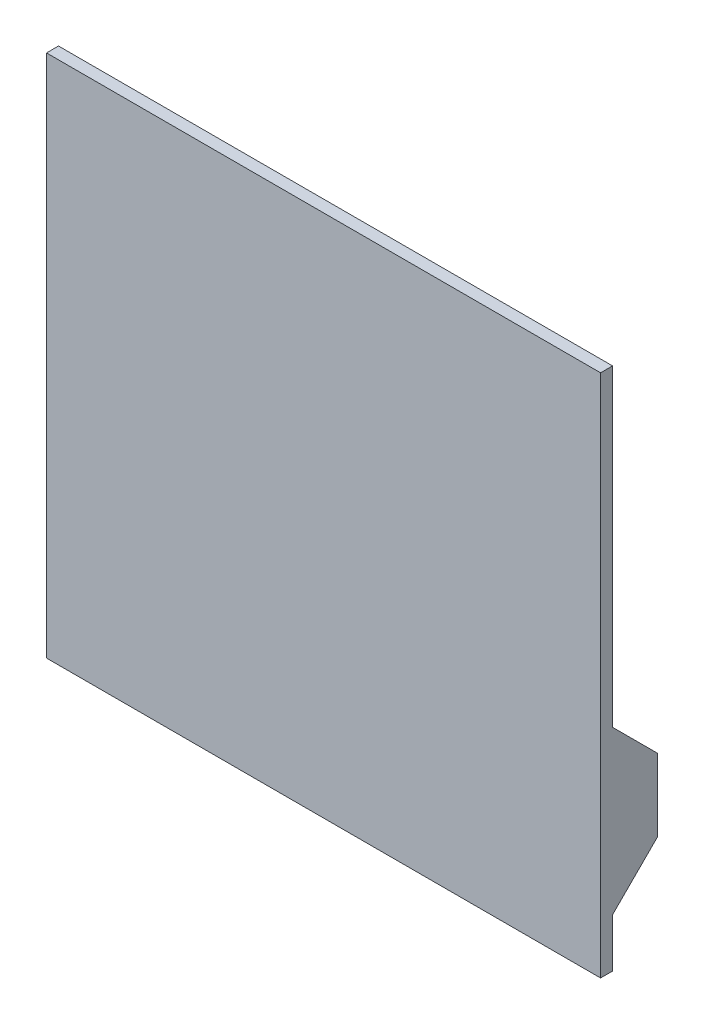
from build123d import *

# Parameters (mm, degrees)
SKETCH_1_W          = 185
SKETCH_1_H          = 175
EXTRUDE_1_DEPTH     = 4
SKETCH_2_W          = 140
SKETCH_2_H          = 6
EXTRUDE_2_DEPTH     = 15
CUT_EXTRUDE_1_REACH = 210.987
SKETCH_4_W          = 45
SKETCH_4_H          = 9
SKETCH_4_H_2        = 6
EXTRUDE_5_DEPTH     = 15
SKETCH_7_W          = 185
SKETCH_7_H          = 4
EXTRUDE_6_DEPTH     = 40
SKETCH_6_W          = 185
SKETCH_6_H          = 4
CUT_EXTRUDE_3_DEPTH = 40
CUT_EXTRUDE_START   = -24.2
SKETCH_5_R          = 1.6
CUT_EXTRUDE_2_DEPTH = 24.2
EXTRUDE_7_DEPTH     = 3
EXTRUDE_8_DEPTH     = 4
EXTRUDE_9_DEPTH     = 4


with BuildPart() as part:
    # 草圖1 → 填料-伸長1 (new body)
    with BuildSketch(Plane.XY):
        with Locations((21.366509782, 20.973731884)):
            Rectangle(SKETCH_1_W, SKETCH_1_H)
    extrude(amount=EXTRUDE_1_DEPTH)

    # 草圖2 → 填料-伸長2 (add)
    with BuildSketch(Plane(origin=(0, 0, 0), x_dir=(-1, 0, 0), z_dir=(0, 0, -1))):
        with Locations((1.133490218, -63.126268116)):
            Rectangle(SKETCH_2_W, SKETCH_2_H)
        with Locations((1.133490218, -47.926268116)):
            Rectangle(SKETCH_2_W, SKETCH_2_H)
    extrude(amount=EXTRUDE_2_DEPTH)

    # 除料-伸長1: up to this face of the body (flat: up to its plane)
    cut_extrude_1_end = Plane(part.part.faces().sort_by_distance((-1.133490218, -44.926268116, -7.5))[0])
    # 草圖3 → 除料-伸長1 (cut, up to the picked face)
    with BuildSketch(Plane.XZ.offset(66.126268116), mode=Mode.PRIVATE) as cut_extrude_1_sk1:
        with BuildLine():
            Line((-65.133490218, -8.4), (62.866509782, -8.4))
            ThreePointArc((62.866509782, -8.4), (64.466509782, -10), (62.866509782, -11.6))
            Line((62.866509782, -11.6), (-65.133490218, -11.6))
            ThreePointArc((-65.133490218, -11.6), (-66.733490218, -10), (-65.133490218, -8.4))
        make_face()
    cut_extrude_1_tool1 = split(extrude(cut_extrude_1_sk1.sketch, amount=-CUT_EXTRUDE_1_REACH, mode=Mode.PRIVATE), bisect_by=cut_extrude_1_end, keep=Keep.BOTH, mode=Mode.PRIVATE)
    add(cut_extrude_1_tool1.solids().sort_by(Axis((-1.13349, -66.126268, -10), (0, 1, 0)))[0], mode=Mode.SUBTRACT)

    # 草圖4 → 填料-伸長5 (add)
    with BuildSketch(Plane(origin=(0, 0, 0), x_dir=(-1, 0, 0), z_dir=(0, 0, -1))):
        with Locations((-91.366509782, -55.526268116)):
            Rectangle(SKETCH_4_W, SKETCH_4_H)
        with Locations((-91.366509782, -72.226268116)):
            Rectangle(SKETCH_4_W, SKETCH_4_H_2)
    extrude(amount=EXTRUDE_5_DEPTH)


with BuildPart() as extrude_5_piece_1:
    # of the separate pieces the step leaves, piece 1, a body of its own (extrude_5_pieces)
    add(part.part.solids().sort_by_distance((-71.133490218, 108.473731884, 0))[0])

    # 草圖7 → 填料-伸長6 (add)
    with BuildSketch(Plane.XZ.offset(66.526268116)):
        with Locations((21.366509782, 2)):
            Rectangle(SKETCH_7_W, SKETCH_7_H)
    extrude(amount=EXTRUDE_6_DEPTH)

    # 草圖6 → 除料-伸長3 (cut)
    with BuildSketch(Plane(origin=(0, 108.473731884, 0), x_dir=(1, 0, 0), z_dir=(0, 1, 0))):
        with Locations((21.366509782, -2)):
            Rectangle(SKETCH_6_W, SKETCH_6_H)
    extrude(amount=-CUT_EXTRUDE_3_DEPTH, mode=Mode.SUBTRACT)


with BuildPart() as extrude_5_piece_2:
    # of the separate pieces the step leaves, piece 2, a body of its own (extrude_5_pieces)
    add(part.part.solids().sort_by_distance((68.866509782, -69.226268116, 0))[0])


with BuildPart() as cut_extrude_2_tool:
    # 草圖5 → 除料-伸長2 (new body)
    with BuildSketch(Plane.XZ.offset(75.226268116).offset(CUT_EXTRUDE_START)):
        with Locations(Location((97.366509782, -10, 0), (0, 0, 270))):
            Circle(SKETCH_5_R)
    extrude(amount=CUT_EXTRUDE_2_DEPTH)


with BuildPart() as extrude_5_piece_1_1:
    add(extrude_5_piece_1.part)

    # 除料-伸長2: cut by cut_extrude_2_tool
    add(cut_extrude_2_tool.part, mode=Mode.SUBTRACT)



with BuildPart() as extrude_5_piece_2_1:
    add(extrude_5_piece_2.part)

    # 除料-伸長2: cut by cut_extrude_2_tool
    add(cut_extrude_2_tool.part, mode=Mode.SUBTRACT)


with BuildPart() as extrude_5_piece_1_2:
    add(extrude_5_piece_1_1.part)

    add(extrude_5_piece_2_1.part)  # 填料-伸長7 merges 填料-伸長5 piece 2
    # 草圖8 → 填料-伸長7 (add)
    with BuildSketch(Plane(origin=(68.866509782, 0, 0), x_dir=(0, 0, -1), z_dir=(1, 0, 0))):
        Polygon((15, -44.926268116), (15, -75.226268116), (0, -90.226268116), (0, -29.926268116), align=None)
    extrude(amount=EXTRUDE_7_DEPTH)

    # 草圖9 → 填料-伸長8 (add)
    with BuildSketch(Plane(origin=(113.866509782, 0, 0), x_dir=(0, 0, -1), z_dir=(1, 0, 0))):
        Polygon((15, -51.026268116), (15, -75.226268116), (0, -90.226268116), (0, -36.026268116), align=None)
    extrude(amount=-EXTRUDE_8_DEPTH)

    # 草圖11 → 填料-伸長9 (add)
    with BuildSketch(Plane.ZY.offset(71.133490218)):
        Polygon((-15, -66.126268116), (-15, -44.926268116), (0, -29.926268116), (0, -81.126268116), align=None)
    extrude(amount=-EXTRUDE_9_DEPTH)


solid = extrude_5_piece_1_2.part
